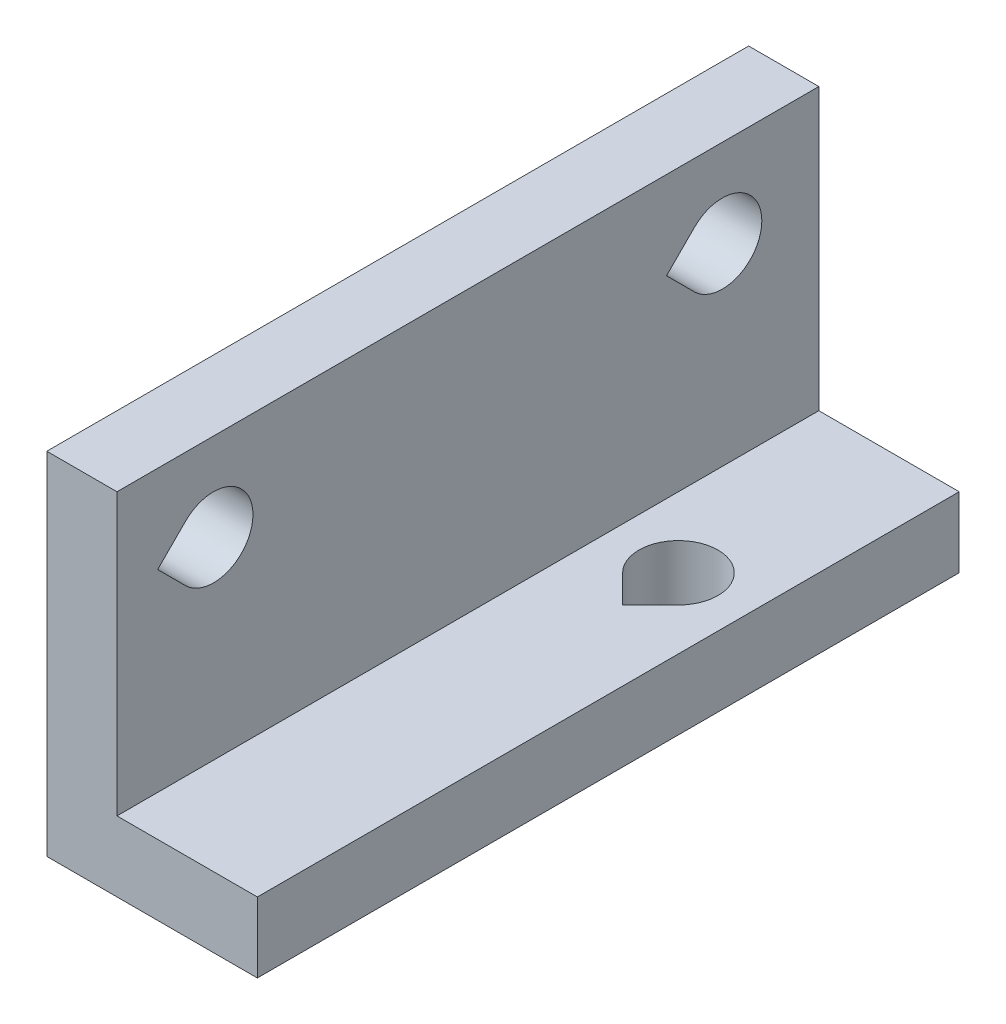
from build123d import *

# Parameters (mm, degrees)
BOSS_EXTRUDE1_DEPTH = 40
CUT_EXTRUDE1_DEPTH  = 46.617978912
CUT_EXTRUDE2_DEPTH  = 50.839743178
SKETCH8_W           = 6
SKETCH8_H           = 40
CUT_EXTRUDE4_DEPTH  = 46.617978912


with BuildPart() as part:
    # Sketch1 → Boss-Extrude1 (new body)
    with BuildSketch(Plane.XY):
        Polygon((-15, 0), (15, 0), (15, 4), (7, 4), (7, 20), (3, 20), (3, 4), (-3, 4), (-3, 20), (-7, 20), (-7, 4), (-15, 4), align=None)
    extrude(amount=BOSS_EXTRUDE1_DEPTH)

    # Sketch2 → Cut-Extrude1 (cut, through all)
    with BuildSketch(Plane(origin=(0, 4, 0), x_dir=(1, 0, 0), z_dir=(0, 1, 0))):
        with BuildLine():
            Line((-12.590990258, -13.590990258), (-11, -15.181980515))
            Line((-11, -15.181980515), (-9.409009742, -13.590990258))
            ThreePointArc((-9.409009742, -13.590990258), (-11, -9.75), (-12.590990258, -13.590990258))
        make_face()
        with BuildLine():
            Line((9.409009742, -13.590990258), (11, -15.181980515))
            Line((11, -15.181980515), (12.590990258, -13.590990258))
            ThreePointArc((12.590990258, -13.590990258), (11, -9.75), (9.409009742, -13.590990258))
        make_face()
    extrude(amount=-CUT_EXTRUDE1_DEPTH, mode=Mode.SUBTRACT)

    # Sketch3 → Cut-Extrude2 (cut, through all)
    with BuildSketch(Plane(origin=(7, 0, 0), x_dir=(0, 0, -1), z_dir=(1, 0, 0))):
        with BuildLine():
            Line((-7.090990258, 16.590990258), (-8.681980515, 15))
            Line((-8.681980515, 15), (-7.090990258, 13.409009742))
            ThreePointArc((-7.090990258, 13.409009742), (-3.25, 15), (-7.090990258, 16.590990258))
        make_face()
        with BuildLine():
            Line((-36.090990258, 16.590990258), (-37.681980515, 15))
            Line((-37.681980515, 15), (-36.090990258, 13.409009742))
            ThreePointArc((-36.090990258, 13.409009742), (-32.25, 15), (-36.090990258, 16.590990258))
        make_face()
    extrude(amount=-CUT_EXTRUDE2_DEPTH, mode=Mode.SUBTRACT)

    # Sketch8 → Cut-Extrude4 (cut, through all)
    with BuildSketch(Plane(origin=(0, 4, 0), x_dir=(1, 0, 0), z_dir=(0, 1, 0))):
        with Locations((0, -20)):
            Rectangle(SKETCH8_W, SKETCH8_H)
    extrude(amount=-CUT_EXTRUDE4_DEPTH, mode=Mode.SUBTRACT)


with BuildPart() as cut_extrude4_piece_1:
    # of the separate pieces the step leaves, piece 1, a body of its own (cut_extrude4_pieces)
    add(part.part.solids().sort_by_distance((-15, 0, 0))[0])


with BuildPart() as cut_extrude4_piece_2:
    # of the separate pieces the step leaves, piece 2, a body of its own (cut_extrude4_pieces)
    add(part.part.solids().sort_by_distance((3, 0, 0))[0])


solid = cut_extrude4_piece_2.part
